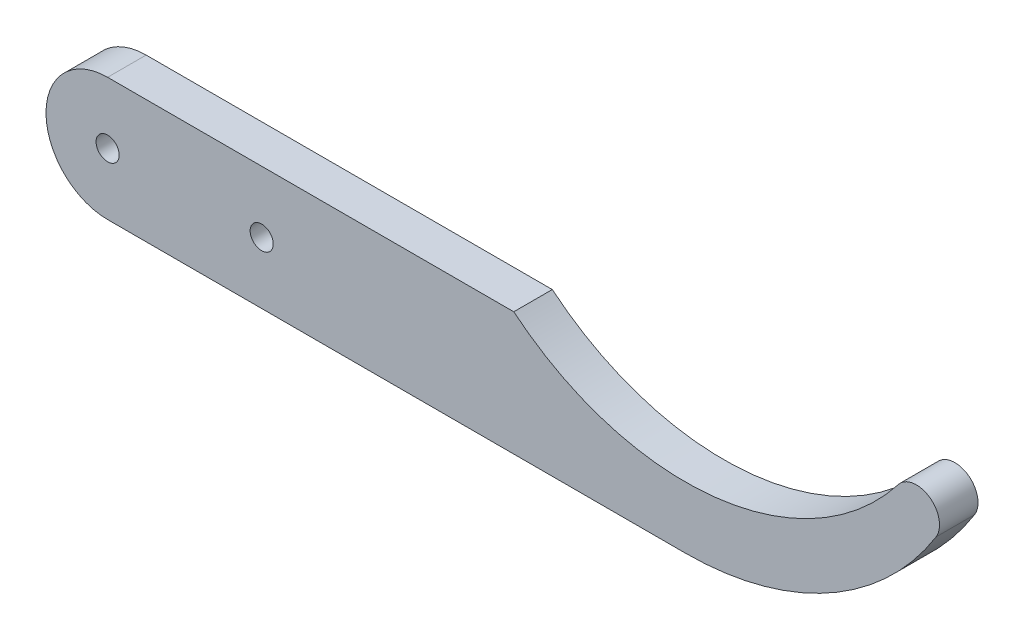
from build123d import *

# Parameters (mm, degrees)
ESQUISSE1_R        = 1.5
BOSS_EXTRU_1_DEPTH = 5


with BuildPart() as part:
    # Esquisse1 → Boss.-Extru.1 (new body)
    with BuildSketch(Plane.XY):
        with BuildLine():
            Line((0, 8), (20, 8))
            Line((20, 8), (32.728942549, 8))
            ThreePointArc((32.728942549, 8), (58.84637819, 0.211993808), (82.631578947, 13.517545651))
            ThreePointArc((82.631578947, 13.517545651), (86.714862069, 14.137746418), (87.547938522, 10.092522856))
            ThreePointArc((87.547938522, 10.092522856), (73.619262105, -3.172854276), (55, -8))
            Line((55, -8), (0, -8))
            Line((0, -8), (-20, -8))
            ThreePointArc((-20, -8), (-28, 0), (-20, 8))
            Line((-20, 8), (0, 8))
        make_face()
        Circle(ESQUISSE1_R, mode=Mode.SUBTRACT)
        with Locations((-20, 0)):
            Circle(ESQUISSE1_R, mode=Mode.SUBTRACT)
    extrude(amount=BOSS_EXTRU_1_DEPTH)


solid = part.part
